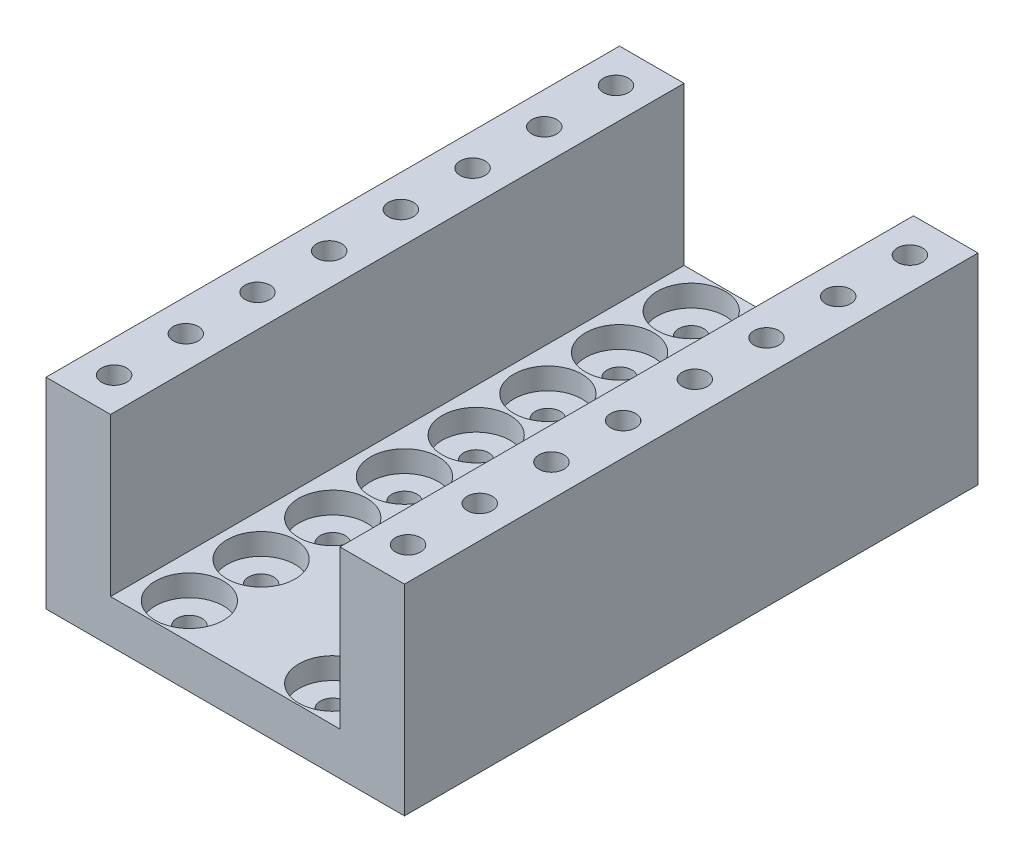
from build123d import *

# Parameters (mm, degrees)
BOSS_EXTRUDE1_DEPTH = 80
SKETCH2_R           = 1.75
CUT_EXTRUDE1_DEPTH  = 87.654486324
SKETCH3_R           = 4.75
CUT_EXTRUDE2_DEPTH  = 3
SKETCH4_R           = 1.75
CUT_EXTRUDE3_DEPTH  = 89.36854644
LPATTERN1_COUNT     = 8
LPATTERN1_PITCH     = 10


with BuildPart() as part:
    # Sketch1 → Boss-Extrude1 (new body)
    with BuildSketch(Plane.XY):
        Polygon((16, 14), (25, 14), (25, -14), (-25, -14), (-25, 14), (-16, 14), (-16, -8), (16, -8), align=None)
    extrude(amount=BOSS_EXTRUDE1_DEPTH)

    # Sketch2 → Cut-Extrude1 (cut, through all)
    with BuildSketch(Plane(origin=(0, -8, 0), x_dir=(1, 0, 0), z_dir=(0, 1, 0))):
        with Locations(Location((-10, -5, 0), (0, 0, 180))):
            Circle(SKETCH2_R)
        with Locations(Location((10, -5, 0), (0, 0, 180))):
            Circle(SKETCH2_R)
    cut_extrude1 = extrude(amount=-CUT_EXTRUDE1_DEPTH, mode=Mode.SUBTRACT)

    # Sketch3 → Cut-Extrude2 (cut)
    with BuildSketch(Plane(origin=(0, -8, 0), x_dir=(1, 0, 0), z_dir=(0, 1, 0))):
        with Locations(Location((-10, -5, 0), (0, 0, 180))):
            Circle(SKETCH3_R)
        with Locations(Location((10, -5, 0), (0, 0, 180))):
            Circle(SKETCH3_R)
    cut_extrude2 = extrude(amount=-CUT_EXTRUDE2_DEPTH, mode=Mode.SUBTRACT)

    # Sketch4 → Cut-Extrude3 (cut, through all)
    with BuildSketch(Plane(origin=(0, 14, 0), x_dir=(1, 0, 0), z_dir=(0, 1, 0))):
        with Locations(Location((-20.5, -5, 0), (0, 0, 180))):
            Circle(SKETCH4_R)
        with Locations(Location((20.5, -5, 0), (0, 0, 180))):
            Circle(SKETCH4_R)
    cut_extrude3 = extrude(amount=-CUT_EXTRUDE3_DEPTH, mode=Mode.SUBTRACT)

    # LPattern1: Cut-Extrude1, Cut-Extrude2, Cut-Extrude3 ×8
    with Locations(*[(0, 0, i * LPATTERN1_PITCH) for i in range(1, LPATTERN1_COUNT)]):
        add(cut_extrude1, mode=Mode.SUBTRACT)
        add(cut_extrude2, mode=Mode.SUBTRACT)
        add(cut_extrude3, mode=Mode.SUBTRACT)


solid = part.part
